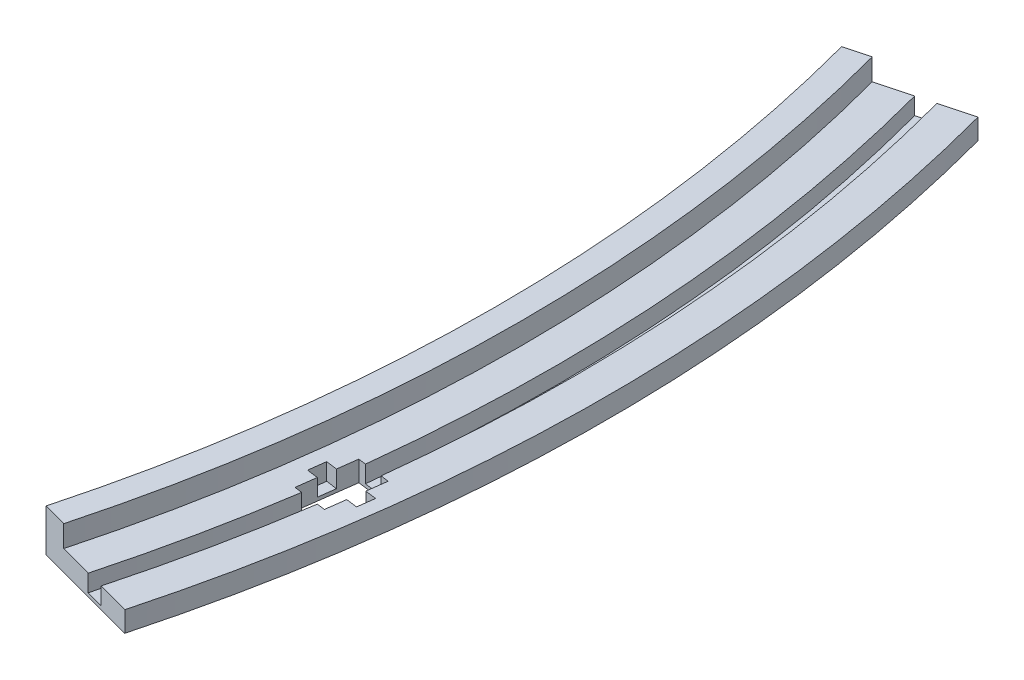
from build123d import *

# Parameters (mm, degrees)
AUFSATZ_LINEAR_AUSTRAGEN1_DEPTH = 3.6
SCHNITT_LINEAR_AUSTRAGEN1_DEPTH = 3
SCHNITT_LINEAR_AUSTRAGEN2_DEPTH = 300.577355237
SCHNITT_LINEAR_AUSTRAGEN3_DEPTH = 3
AUFSATZ_LINEAR_AUSTRAGEN2_DEPTH = 3.8


with BuildPart() as part:
    # Skizze1 → Aufsatz-Linear austragen1 (new body)
    with BuildSketch(Plane(origin=(0, 0, 0), x_dir=(1, 0, 0), z_dir=(0, 1, 0))):
        with BuildLine():
            Line((280.118489624, 75.05752308), (261.186343429, 69.984669796))
            ThreePointArc((261.186343429, 69.984669796), (270.4, 0), (261.186343429, -69.984669796))
            Line((261.186343429, -69.984669796), (280.118489624, -75.05752308))
            ThreePointArc((280.118489624, -75.05752308), (290, 0), (280.118489624, 75.05752308))
        make_face()
    extrude(amount=AUFSATZ_LINEAR_AUSTRAGEN1_DEPTH)

    # Skizze2 → Schnitt-Linear austragen1 (cut)
    with BuildSketch(Plane(origin=(0, 3.6, 0), x_dir=(1, 0, 0), z_dir=(0, 1, 0))):
        with BuildLine():
            Line((271.328564605, 72.702269769), (274.419527249, 73.530490714))
            ThreePointArc((274.419527249, 73.530490714), (284.1, 0), (274.419527249, -73.530490714))
            Line((274.419527249, -73.530490714), (271.328564605, -72.702269769))
            ThreePointArc((271.328564605, -72.702269769), (280.9, 0), (271.328564605, 72.702269769))
        make_face()
    extrude(amount=-SCHNITT_LINEAR_AUSTRAGEN1_DEPTH, mode=Mode.SUBTRACT)

    # Skizze3 → Schnitt-Linear austragen2 (cut, through all)
    with BuildSketch(Plane(origin=(0, 3.6, 0), x_dir=(1, 0, 0), z_dir=(0, 1, 0))):
        Polygon((276.456207793, -41.439295032), (282.404876961, -42.222452186), (283.710138883, -32.308003572), (277.761469715, -31.524846419), align=None)
    extrude(amount=-SCHNITT_LINEAR_AUSTRAGEN2_DEPTH, mode=Mode.SUBTRACT)

    # Skizze4 → Schnitt-Linear austragen3 (cut)
    with BuildSketch(Plane(origin=(0, 3.6, 0), x_dir=(1, 0, 0), z_dir=(0, 1, 0))):
        Polygon((275.32173832, -34.733851049), (285.236186933, -36.039112971), (284.844608357, -39.013447555), (274.930159743, -37.708185633), align=None)
    extrude(amount=-SCHNITT_LINEAR_AUSTRAGEN3_DEPTH, mode=Mode.SUBTRACT)

    # Skizze5 → Aufsatz-Linear austragen2 (add)
    with BuildSketch(Plane(origin=(0, 3.6, 0), x_dir=(1, 0, 0), z_dir=(0, 1, 0))):
        with BuildLine():
            Line((261.186343429, 69.984669796), (265.436417064, 71.123473594))
            ThreePointArc((265.436417064, 71.123473594), (274.8, 0), (265.436417064, -71.123473594))
            Line((265.436417064, -71.123473594), (261.186343429, -69.984669796))
            ThreePointArc((261.186343429, -69.984669796), (270.4, 0), (261.186343429, 69.984669796))
        make_face()
    extrude(amount=AUFSATZ_LINEAR_AUSTRAGEN2_DEPTH)


solid = part.part
